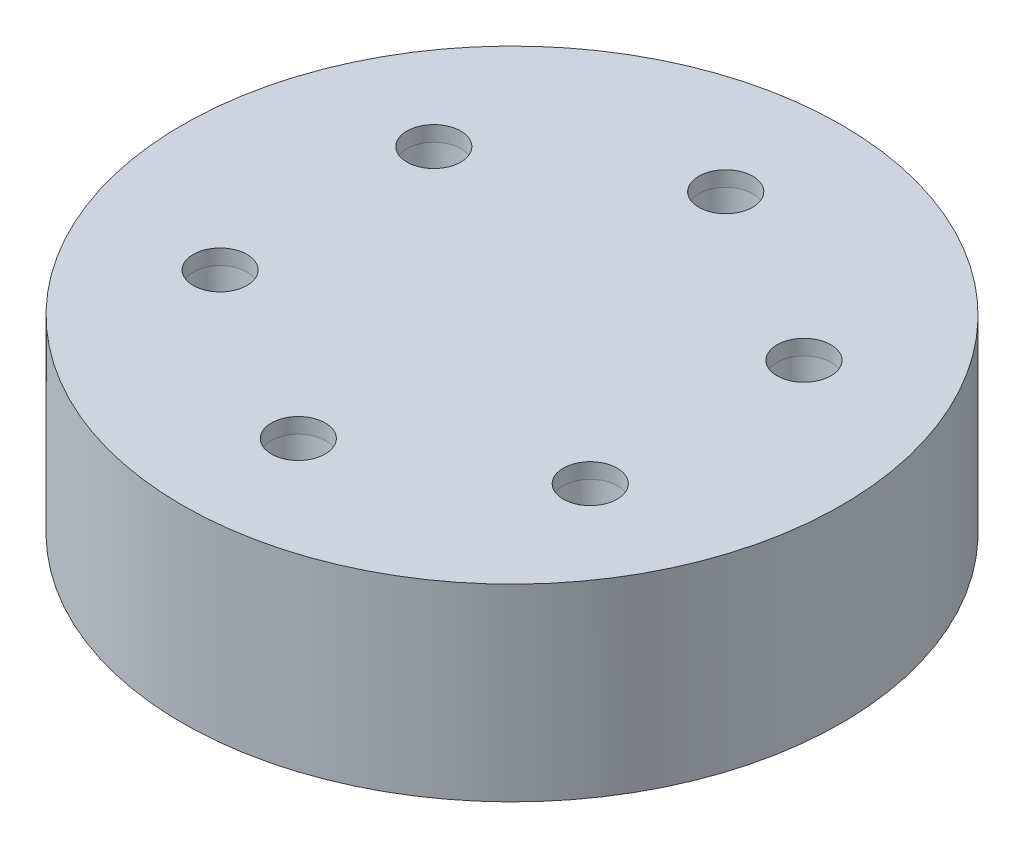
from build123d import *

# Parameters (mm, degrees)
SKETCH2_R           = 36.7
BOSS_EXTRUDE1_DEPTH = 11
SKETCH5_R           = 14.1
CUT_EXTRUDE1_DEPTH  = 4.5
BOSS_EXTRUDE2_START = 10
SKETCH7_R           = 36.7
SKETCH7_R_2         = 31.7
BOSS_EXTRUDE2_DEPTH = 10
CIRPATTERN1_COUNT   = 6


with BuildPart() as part:
    # Sketch2 → Boss-Extrude1 (new body)
    with BuildSketch(Plane(origin=(0, 0, 0), x_dir=(1, 0, 0), z_dir=(0, 1, 0))):
        with Locations(Location((0, 0, 0), (0, 0, 270))):
            Circle(SKETCH2_R)
    extrude(amount=BOSS_EXTRUDE1_DEPTH)

    # Sketch3 → Cut-Revolve1 (revolve, cut)
    with BuildSketch(Plane(origin=(0, 0, 0), x_dir=(0, 0, -1), z_dir=(1, 0, 0))):
        Polygon((26.8, 11), (26.8, 9.3), (25.9, 0.5), (25.9, 0), (23.8, 0), (23.8, 11), align=None)
    cut_revolve1 = revolve(axis=Axis((0, 0, -23.8), (0, 1, 0)), mode=Mode.SUBTRACT)

    # Sketch5 → Cut-Extrude1 (cut)
    with BuildSketch(Plane.XZ):
        with Locations(Location((0, 0, 0), (0, 0, 270))):
            Circle(SKETCH5_R)
    extrude(amount=-CUT_EXTRUDE1_DEPTH, mode=Mode.SUBTRACT)

    # Sketch7 → Boss-Extrude2 (add)
    with BuildSketch(Plane.XZ.offset(BOSS_EXTRUDE2_START)):
        with Locations(Location((0, 0, 0), (0, 0, 270))):
            Circle(SKETCH7_R)
        with Locations(Location((0, 0, 0), (0, 0, 270))):
            Circle(SKETCH7_R_2, mode=Mode.SUBTRACT)
    extrude(amount=-BOSS_EXTRUDE2_DEPTH)

    # CirPattern1: Cut-Revolve1 ×6 about axis
    cirpattern1_axis = Axis((0, 0, 0), (0, 1, 0))
    for i in range(1, CIRPATTERN1_COUNT):
        add(cut_revolve1.rotate(cirpattern1_axis, i * 360 / CIRPATTERN1_COUNT), mode=Mode.SUBTRACT)


solid = part.part
